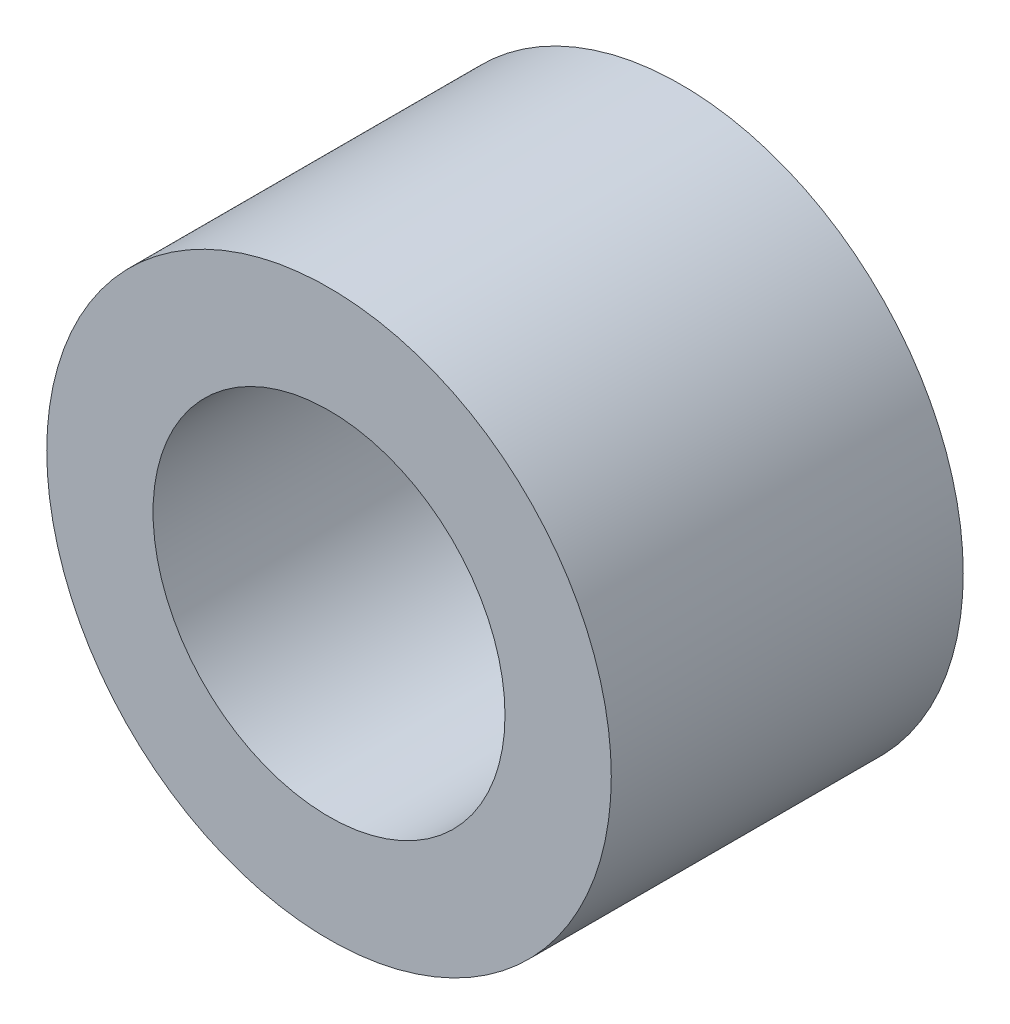
from build123d import *

# Parameters (mm, degrees)
SKETCH1_R      = 4.01
SKETCH1_R_2    = 2.5
EXTRUDE1_DEPTH = 2.5


with BuildPart() as part:
    # Sketch1 → Extrude1 (new, symmetric)
    with BuildSketch(Plane.XY):
        Circle(SKETCH1_R)
        Circle(SKETCH1_R_2, mode=Mode.SUBTRACT)
    extrude(amount=EXTRUDE1_DEPTH, both=True)


solid = part.part
